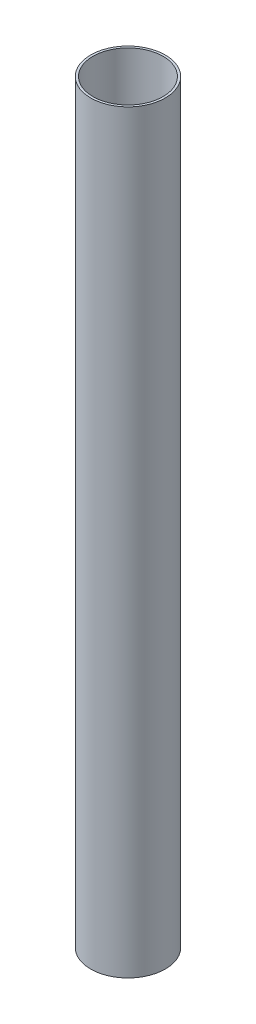
from build123d import *

# Parameters (mm, degrees)
SKETCH1_R           = 27
SKETCH1_R_2         = 25.35
BOSS_EXTRUDE1_DEPTH = 546.1


with BuildPart() as part:
    # Sketch1 → Boss-Extrude1 (new body)
    with BuildSketch(Plane(origin=(0, 0, 0), x_dir=(1, 0, 0), z_dir=(0, 1, 0))):
        with Locations(Location((0, 0, 0), (0, 0, 270))):
            Circle(SKETCH1_R)
        with Locations(Location((0, 0, 0), (0, 0, 270))):
            Circle(SKETCH1_R_2, mode=Mode.SUBTRACT)
    extrude(amount=BOSS_EXTRUDE1_DEPTH)


solid = part.part
